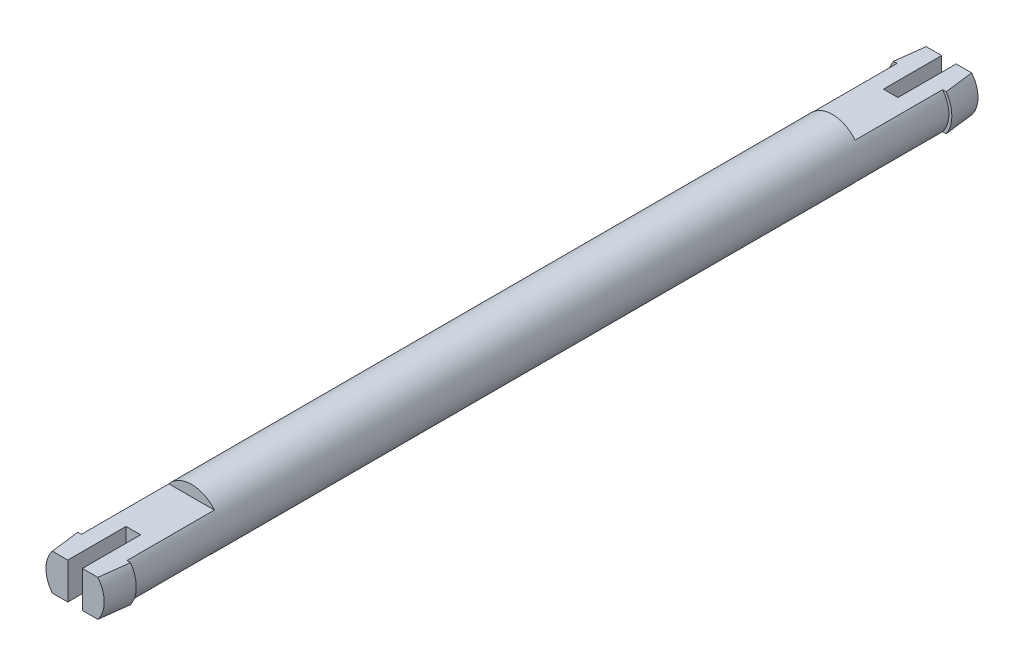
from build123d import *

# Parameters (mm, degrees)
SKETCH_1_R               = 2
EXTRUDE_1_DEPTH          = 60
SKETCH_3_W               = 4.2
SKETCH_3_H               = 1
CUT_EXTRUDE_1_DEPTH      = 8
CUT_EXTRUDE_2_REACH      = 62.128
SKETCH_4_W               = 1
SKETCH_4_H               = 4
SKETCH_6_W               = 4.2
SKETCH_6_H               = 1
CUT_EXTRUDE_3_DEPTH      = 8
CUT_EXTRUDE_4_DEPTH      = 61.073621499
CUT_EXTRUDE_4_DEPTH_BACK = 61.073621499
SKETCH_7_W               = 1
SKETCH_7_H               = 4


with BuildPart() as part:
    # 草图1 → 凸台-拉伸1 (new body)
    with BuildSketch(Plane.XY):
        Circle(SKETCH_1_R)
    extrude(amount=-EXTRUDE_1_DEPTH)

    # 草图2 → 旋转1 (revolve)
    with BuildSketch(Plane(origin=(0, 0, 0), x_dir=(1, 0, 0), z_dir=(0, 1, 0))):
        Polygon((0, 0), (0, 2), (2.2, 2), (2, 0), align=None)
    revolve(axis=Axis((0, 0, 0), (0, 0, -1)))

    # 草图3 → 切除-拉伸1 (cut)
    with BuildSketch(Plane.XY):
        with Locations((0, 1.75)):
            Rectangle(SKETCH_3_W, SKETCH_3_H)
        with Locations((0, -1.75)):
            Rectangle(SKETCH_3_W, SKETCH_3_H)
    extrude(amount=-CUT_EXTRUDE_1_DEPTH, mode=Mode.SUBTRACT)

    # 草图4 → 切除-拉伸2 (cut, up to next)
    with BuildSketch(Plane.XZ.offset(1.25), mode=Mode.PRIVATE) as cut_extrude_2_sk1:
        with Locations((0, -2)):
            Rectangle(SKETCH_4_W, SKETCH_4_H)
    cut_extrude_2_tool1 = extrude(cut_extrude_2_sk1.sketch, amount=-CUT_EXTRUDE_2_REACH, mode=Mode.PRIVATE) & part.part
    add(cut_extrude_2_tool1.solids().sort_by_distance((0, -1.25, -2))[0], mode=Mode.SUBTRACT)

    # 草图5 → 旋转2 (revolve)
    with BuildSketch(Plane(origin=(0, 0, 0), x_dir=(1, 0, 0), z_dir=(0, 1, 0))):
        Polygon((0, 60), (0, 58), (2.2, 58), (2, 60), align=None)
    revolve(axis=Axis((0, 0, -58.137689197), (0, 0, -1)))

    # 草图6 → 切除-拉伸3 (cut)
    with BuildSketch(Plane(origin=(0, 0, -60), x_dir=(-1, 0, 0), z_dir=(0, 0, -1))):
        with Locations((0, 1.75)):
            Rectangle(SKETCH_6_W, SKETCH_6_H)
        with Locations((0, -1.75)):
            Rectangle(SKETCH_6_W, SKETCH_6_H)
    extrude(amount=-CUT_EXTRUDE_3_DEPTH, mode=Mode.SUBTRACT)

    # 草图7 → 切除-拉伸4 (cut, two sides: drawn at the far end of the back side and taken through both)
    with BuildSketch(Plane(origin=(0, 0, 0), x_dir=(1, 0, 0), z_dir=(0, 1, 0)).offset(-CUT_EXTRUDE_4_DEPTH_BACK)):
        with Locations((0, 58)):
            Rectangle(SKETCH_7_W, SKETCH_7_H)
    extrude(amount=CUT_EXTRUDE_4_DEPTH + CUT_EXTRUDE_4_DEPTH_BACK, mode=Mode.SUBTRACT)


solid = part.part
